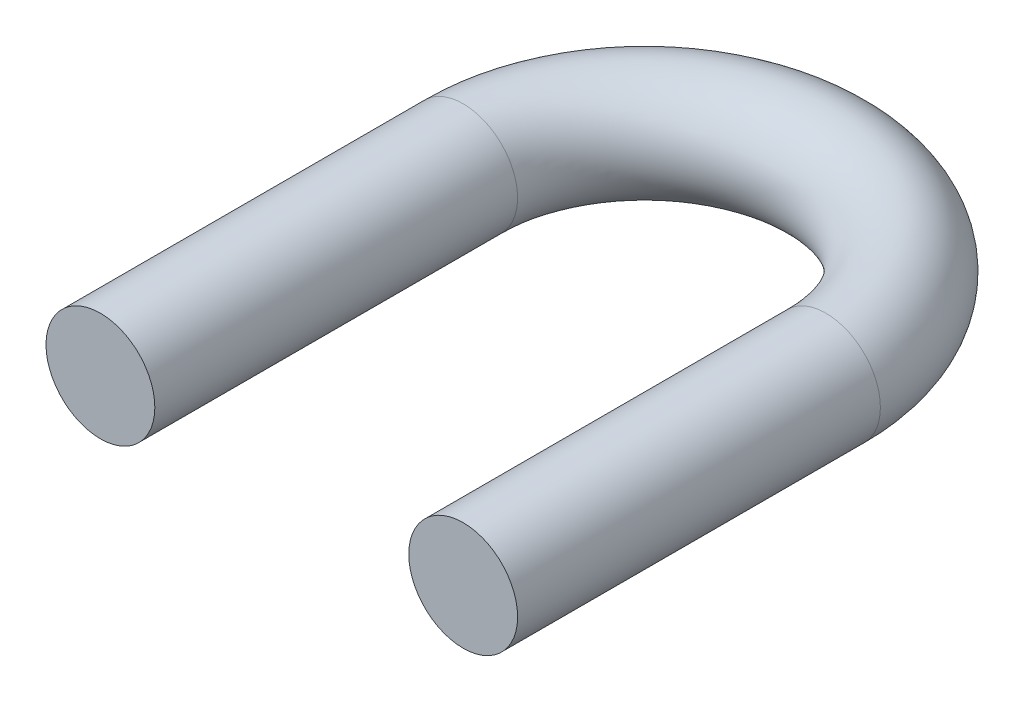
from build123d import *

# Parameters (mm, degrees)
SWEEP1_PROFILE_R = 3


with BuildPart() as part:
    # Sweep1: sweep along a path in Sketch1
    with BuildLine(Plane(origin=(0, 0, 0), x_dir=(1, 0, 0), z_dir=(0, 1, 0))) as sweep1_path:
        Line((-10, -20), (-10, 0))
        ThreePointArc((-10, 0), (0, 10), (10, 0))
        Line((10, 0), (10, -20))
    # Sweep1 profile (on start of the path) → Sweep1 (sweep)
    with BuildSketch(Plane(origin=(-10, 0, 20), x_dir=(-1, 0, 0), z_dir=(0, 0, -1))):
        Circle(SWEEP1_PROFILE_R)
    sweep(path=sweep1_path.line)


solid = part.part
